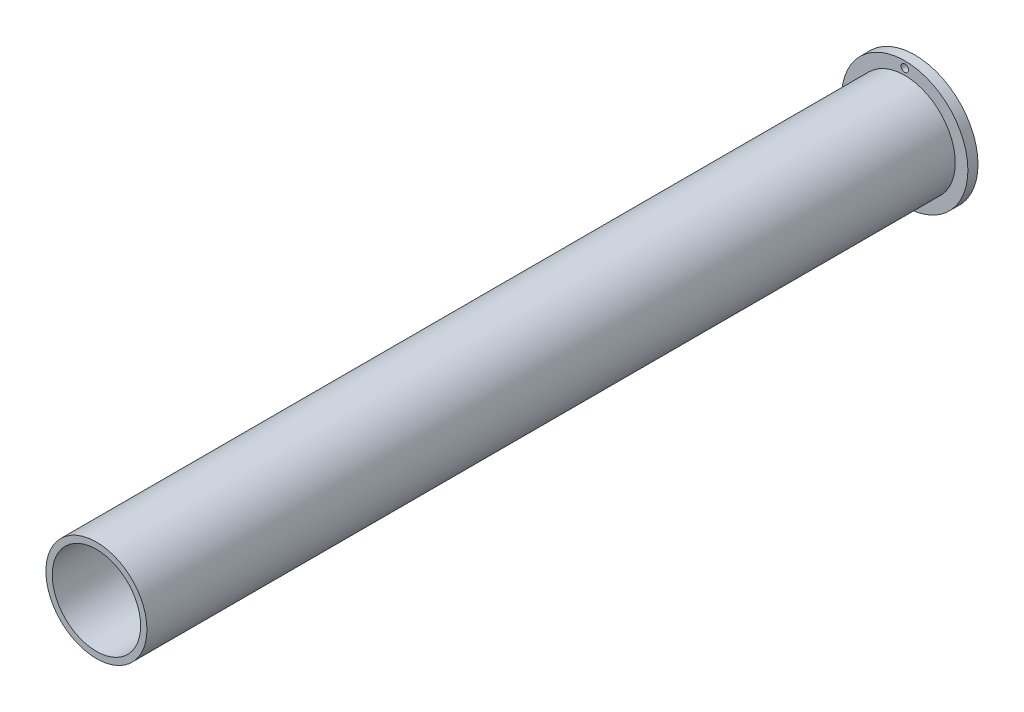
from build123d import *

# Parameters (mm, degrees)
SKETCH1_R           = 15.875
BOSS_EXTRUDE1_DEPTH = 2.54
SKETCH2_R           = 12.7
SKETCH2_R_2         = 11.1125
BOSS_EXTRUDE2_DEPTH = 203.2
SKETCH3_R           = 1.778
CUT_EXTRUDE1_DEPTH  = 2.54
SKETCH4_R           = 0.9271
CUT_EXTRUDE2_DEPTH  = 2.54


with BuildPart() as part:
    # Sketch1 → Boss-Extrude1 (new body)
    with BuildSketch(Plane.XY):
        Circle(SKETCH1_R)
    extrude(amount=BOSS_EXTRUDE1_DEPTH)

    # Sketch2 → Boss-Extrude2 (add)
    with BuildSketch(Plane.XY.offset(2.54)):
        Circle(SKETCH2_R)
        Circle(SKETCH2_R_2, mode=Mode.SUBTRACT)
    extrude(amount=BOSS_EXTRUDE2_DEPTH)

    # Sketch3 → Cut-Extrude1 (cut)
    with BuildSketch(Plane.XY.offset(2.54)):
        with Locations((-8.128, 0)):
            Circle(SKETCH3_R)
        with Locations((8.128, 0)):
            Circle(SKETCH3_R)
    extrude(amount=-CUT_EXTRUDE1_DEPTH, mode=Mode.SUBTRACT)

    # Sketch4 → Cut-Extrude2 (cut)
    with BuildSketch(Plane.XY.offset(2.54)):
        with Locations((0, 14.2875)):
            Circle(SKETCH4_R)
        with Locations((0, -14.2875)):
            Circle(SKETCH4_R)
    extrude(amount=-CUT_EXTRUDE2_DEPTH, mode=Mode.SUBTRACT)


solid = part.part
